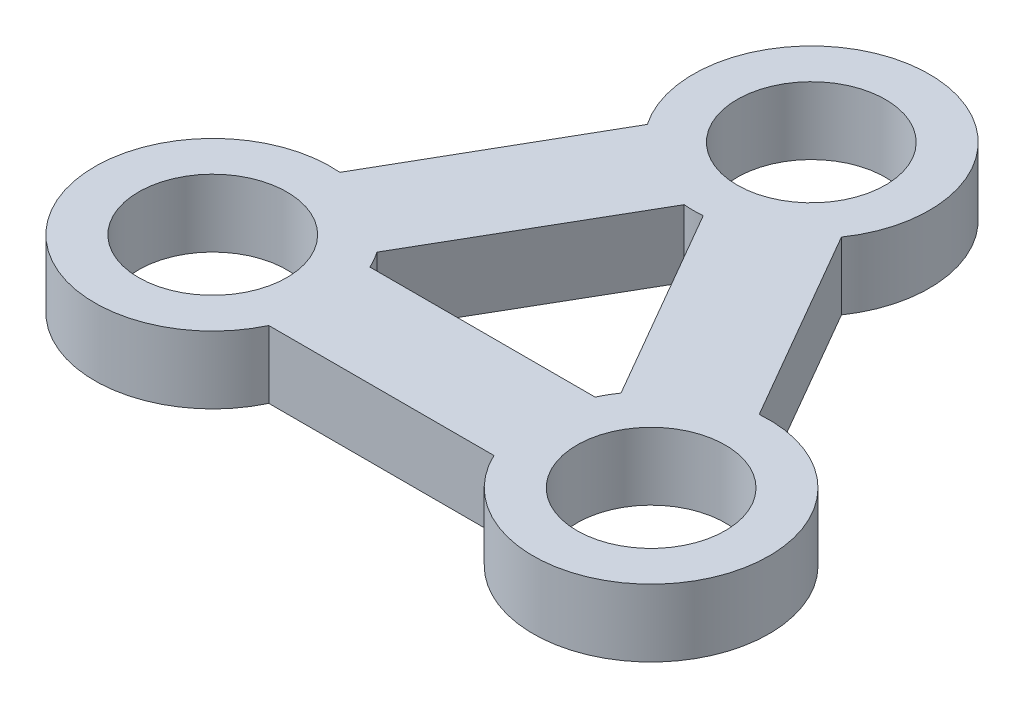
from build123d import *

# Parameters (mm, degrees)
SKETCH1_R           = 22
BOSS_EXTRUDE1_DEPTH = 20


with BuildPart() as part:
    # Sketch1 → Boss-Extrude1 (new body)
    with BuildSketch(Plane(origin=(0, 0, 0), x_dir=(1, 0, 0), z_dir=(0, 1, 0))):
        with BuildLine():
            Line((98.377223398, -15), (31.622776602, -15))
            ThreePointArc((31.622776602, -15), (-30.313693749, -17.495141363), (2.832190618, 34.885221747))
            Line((2.832190618, 34.885221747), (36.097300033, 92.760852739))
            ThreePointArc((36.097300033, 92.760852739), (65.083539163, 147.499900303), (93.808142815, 92.62310619))
            Line((93.808142815, 92.62310619), (127.167809382, 34.885221747))
            ThreePointArc((127.167809382, 34.885221747), (160.313693749, -17.495141363), (98.377223398, -15))
        make_face()
        with Locations(Location((0, 0, 0), (0, 0, 270))):
            Circle(SKETCH1_R, mode=Mode.SUBTRACT)
        with Locations(Location((65, 112.5, 0), (0, 0, 270))):
            Circle(SKETCH1_R, mode=Mode.SUBTRACT)
        with Locations(Location((130, 0, 0), (0, 0, 270))):
            Circle(SKETCH1_R, mode=Mode.SUBTRACT)
        with BuildLine():
            Line((98.377223398, 15), (31.622776602, 15))
            ThreePointArc((31.622776602, 15), (30.313693749, 17.495141363), (28.808142815, 19.87689381))
            Line((28.808142815, 19.87689381), (62.167809382, 77.614778253))
            ThreePointArc((62.167809382, 77.614778253), (65, 77.5), (67.832190618, 77.614778253))
            Line((67.832190618, 77.614778253), (101.191857185, 19.87689381))
            ThreePointArc((101.191857185, 19.87689381), (99.686306251, 17.495141363), (98.377223398, 15))
        make_face(mode=Mode.SUBTRACT)
    extrude(amount=BOSS_EXTRUDE1_DEPTH)


solid = part.part
